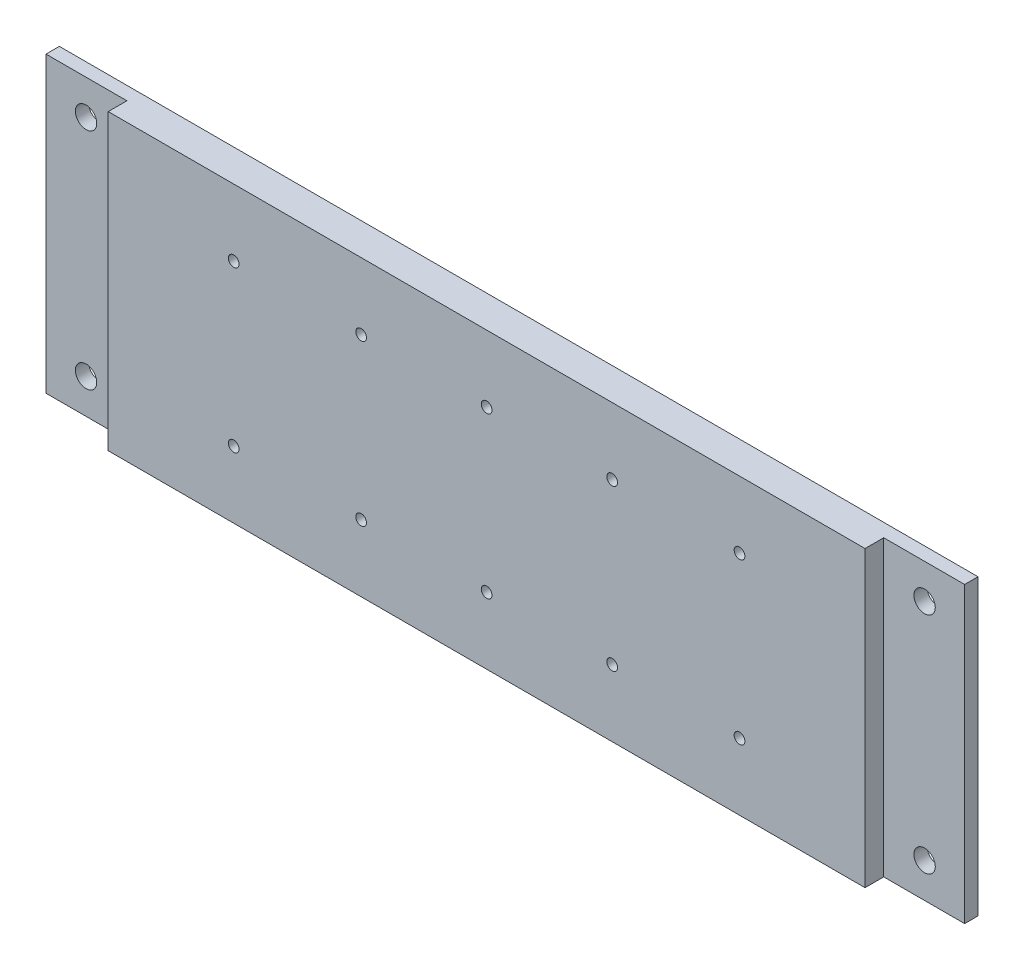
from build123d import *

# Parameters (mm, degrees)
ESQUISSE1_W             = 172
ESQUISSE1_H             = 55
BOSS_EXTRU_1_DEPTH      = 6
ESQUISSE2_W             = 15.15
ESQUISSE2_H             = 55
ENL_V_MAT_EXTRU_1_DEPTH = 3.5
ESQUISSE3_R             = 2
ENL_V_MAT_EXTRU_2_DEPTH = 91.357622811
ESQUISSE4_R             = 1.005
ENL_V_MAT_EXTRU_3_DEPTH = 91.488949602


with BuildPart() as part:
    # Esquisse1 → Boss.-Extru.1 (new body)
    with BuildSketch(Plane.XY):
        Rectangle(ESQUISSE1_W, ESQUISSE1_H)
    extrude(amount=BOSS_EXTRU_1_DEPTH)

    # Esquisse2 → Enlèv. mat.-Extru.1 (cut)
    with BuildSketch(Plane.XY.offset(6)):
        with Locations((-78.425, 0)):
            Rectangle(ESQUISSE2_W, ESQUISSE2_H)
        with Locations((78.425, 0)):
            Rectangle(ESQUISSE2_W, ESQUISSE2_H)
    extrude(amount=-ENL_V_MAT_EXTRU_1_DEPTH, mode=Mode.SUBTRACT)

    # Esquisse3 → Enlèv. mat.-Extru.2 (cut, through all)
    with BuildSketch(Plane.XY.offset(2.5)):
        with Locations(Location((-78.5, 21, 0), (0, 0, 180))):
            Circle(ESQUISSE3_R)
        with Locations((-78.5, -21)):
            Circle(ESQUISSE3_R)
        with Locations(Location((78.5, -21, 0), (0, 0, 180))):
            Circle(ESQUISSE3_R)
        with Locations((78.5, 21)):
            Circle(ESQUISSE3_R)
    extrude(amount=-ENL_V_MAT_EXTRU_2_DEPTH, mode=Mode.SUBTRACT)

    # Esquisse4 → Enlèv. mat.-Extru.3 (cut, through all)
    with BuildSketch(Plane.XY.offset(6)):
        with Locations((-47.35, 15)):
            Circle(ESQUISSE4_R)
        with Locations((-23.5, 15)):
            Circle(ESQUISSE4_R)
        with Locations(Location((23.5, 15, 0), (0, 0, 180))):
            Circle(ESQUISSE4_R)
        with Locations(Location((47.35, 15, 0), (0, 0, 180))):
            Circle(ESQUISSE4_R)
        with Locations((47.35, -15)):
            Circle(ESQUISSE4_R)
        with Locations((23.5, -15)):
            Circle(ESQUISSE4_R)
        with Locations(Location((-23.5, -15, 0), (0, 0, 180))):
            Circle(ESQUISSE4_R)
        with Locations(Location((-47.35, -15, 0), (0, 0, 180))):
            Circle(ESQUISSE4_R)
        with Locations((0, 15)):
            Circle(ESQUISSE4_R)
        with Locations(Location((0, -15, 0), (0, 0, 180))):
            Circle(ESQUISSE4_R)
    extrude(amount=-ENL_V_MAT_EXTRU_3_DEPTH, mode=Mode.SUBTRACT)


solid = part.part
